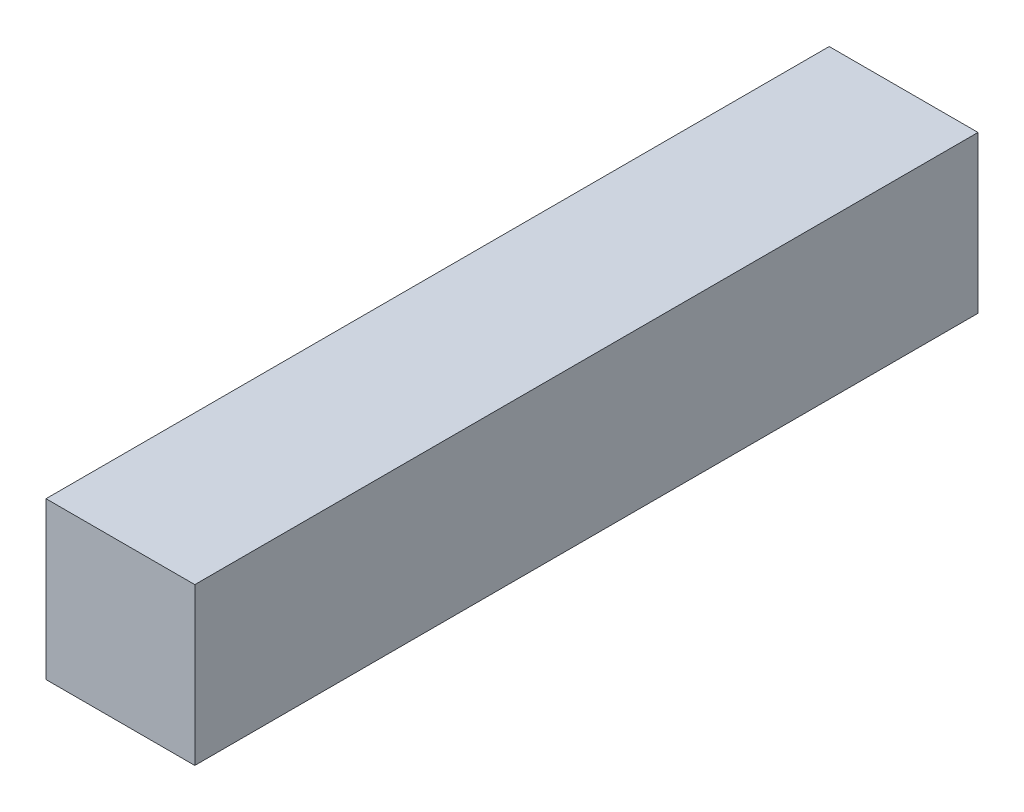
from build123d import *

# Parameters (mm, degrees)
SKETCH1_W           = 1.9
SKETCH1_H           = 2
BOSS_EXTRUDE1_DEPTH = 10


with BuildPart() as part:
    # Sketch1 → Boss-Extrude1 (new body)
    with BuildSketch(Plane.XY):
        Rectangle(SKETCH1_W, SKETCH1_H)
    extrude(amount=BOSS_EXTRUDE1_DEPTH)


solid = part.part
